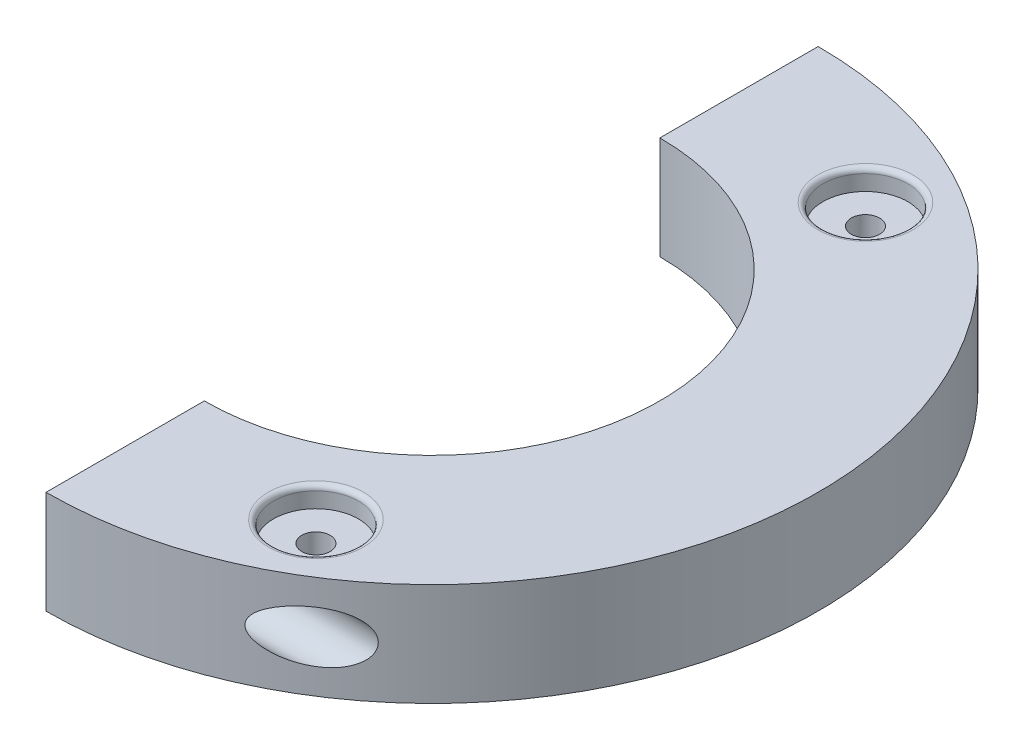
from build123d import *

# Parameters (mm, degrees)
BOSS_EXTRUDE1_DEPTH = 20
SKETCH2_R           = 5
CUT_EXTRUDE1_DEPTH  = 150
SKETCH3_R           = 8.25
CUT_EXTRUDE3_DEPTH  = 4
SKETCH4_R           = 2.75
CUT_EXTRUDE4_DEPTH  = 20
SKETCH5_R           = 5
CUT_EXTRUDE5_DEPTH  = 5
FILLET1_R           = 1


with BuildPart() as part:
    # Sketch1 → Boss-Extrude1 (new body)
    with BuildSketch(Plane(origin=(0, 0, 0), x_dir=(1, 0, 0), z_dir=(0, 1, 0))):
        with BuildLine():
            Line((0, 44.25), (0, 75))
            ThreePointArc((0, 75), (75, 0), (0, -75))
            Line((0, -75), (0, -44.25))
            ThreePointArc((0, -44.25), (44.25, 0), (0, 44.25))
        make_face()
    extrude(amount=BOSS_EXTRUDE1_DEPTH)

    # Sketch2 → Cut-Extrude1 (cut)
    with BuildSketch(Plane.ZY):
        with Locations((-63, 10)):
            Circle(SKETCH2_R)
        with Locations((63, 10)):
            Circle(SKETCH2_R)
    extrude(amount=-CUT_EXTRUDE1_DEPTH, mode=Mode.SUBTRACT)

    # Sketch3 → Cut-Extrude3 (cut)
    with BuildSketch(Plane(origin=(0, 20, 0), x_dir=(1, 0, 0), z_dir=(0, 1, 0))):
        with Locations(Location((30.815, -53.373145635, 0), (0, 0, 270))):
            Circle(SKETCH3_R)
        with Locations(Location((30.815, 53.373145635, 0), (0, 0, 270))):
            Circle(SKETCH3_R)
    extrude(amount=-CUT_EXTRUDE3_DEPTH, mode=Mode.SUBTRACT)

    # Sketch4 → Cut-Extrude4 (cut)
    with BuildSketch(Plane(origin=(0, 16, 0), x_dir=(1, 0, 0), z_dir=(0, 1, 0))):
        with Locations(Location((30.815, 53.373145635, 0), (0, 0, 270))):
            Circle(SKETCH4_R)
        with Locations(Location((30.815, -53.373145635, 0), (0, 0, 270))):
            Circle(SKETCH4_R)
    extrude(amount=-CUT_EXTRUDE4_DEPTH, mode=Mode.SUBTRACT)

    # Sketch5 → Cut-Extrude5 (cut)
    with BuildSketch(Plane.XZ):
        with Locations(Location((30.815, 53.373145635, 0), (0, 0, 270))):
            Circle(SKETCH5_R)
        with Locations(Location((30.815, -53.373145635, 0), (0, 0, 270))):
            Circle(SKETCH5_R)
    extrude(amount=-CUT_EXTRUDE5_DEPTH, mode=Mode.SUBTRACT)

    # Fillet1
    fillet1_edges = [part.edges().sort_by_distance(p)[0] for p in [
        (30.815, 20, 45.123145635),
        (30.815, 20, -61.623145635),
    ]]
    fillet(fillet1_edges, radius=FILLET1_R)


solid = part.part
